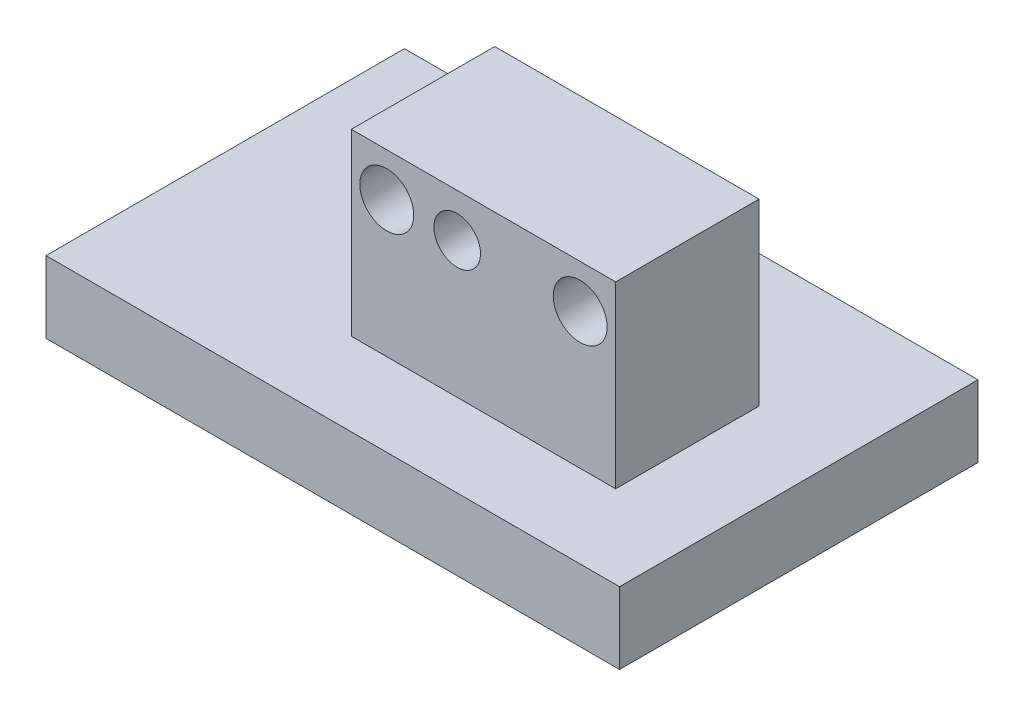
from build123d import *

# Parameters (mm, degrees)
SKETCH1_W           = 80
SKETCH1_H           = 50
MAIN_PLATE_DEPTH    = 10
SKETCH1_3_W         = 36.871622478
SKETCH1_3_H         = 20
BOSS_EXTRUDE2_DEPTH = 25
SKETCH2_R           = 3.760980907
SKETCH2_R_2         = 3.25
CUT_EXTRUDE1_DEPTH  = 20


with BuildPart() as part:
    # Sketch1 → Main Plate (new body)
    with BuildSketch(Plane(origin=(0, 0, 0), x_dir=(1, 0, 0), z_dir=(0, 1, 0))):
        Rectangle(SKETCH1_W, SKETCH1_H)
    extrude(amount=-MAIN_PLATE_DEPTH)

    # Sketch1<3> → Boss-Extrude2 (add)
    with BuildSketch(Plane(origin=(0, 0, 0), x_dir=(1, 0, 0), z_dir=(0, 1, 0))):
        with Locations((9.470325945, -3.44765343)):
            Rectangle(SKETCH1_3_W, SKETCH1_3_H)
    extrude(amount=BOSS_EXTRUDE2_DEPTH)

    # Sketch2 → Cut-Extrude1 (cut)
    with BuildSketch(Plane.XY.offset(13.44765343)):
        with Locations((-4.018286342, 18.961248544)):
            Circle(SKETCH2_R)
        with Locations(Location((22.958938232, 18.961248544, 0), (0, 0, 180))):
            Circle(SKETCH2_R)
        with Locations((5.79860133, 18.961248544)):
            Circle(SKETCH2_R_2)
    extrude(amount=-CUT_EXTRUDE1_DEPTH, mode=Mode.SUBTRACT)


solid = part.part
